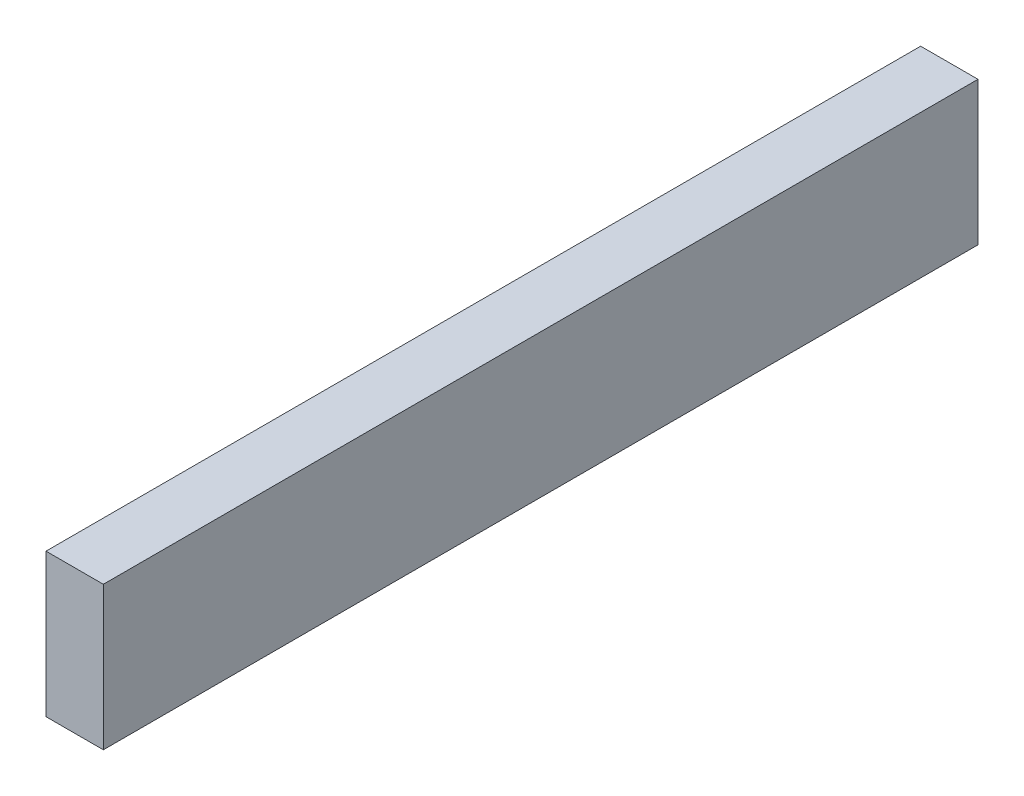
from build123d import *

# Parameters (mm, degrees)
CROQUIS1_W              = 61
CROQUIS1_H              = 10
SALIENTE_EXTRUIR1_DEPTH = 4


with BuildPart() as part:
    # Croquis1 → Saliente-Extruir1 (new body)
    with BuildSketch(Plane(origin=(0, 0, 0), x_dir=(0, 0, -1), z_dir=(1, 0, 0))):
        with Locations((30.5, 5)):
            Rectangle(CROQUIS1_W, CROQUIS1_H)
    extrude(amount=SALIENTE_EXTRUIR1_DEPTH)


solid = part.part
